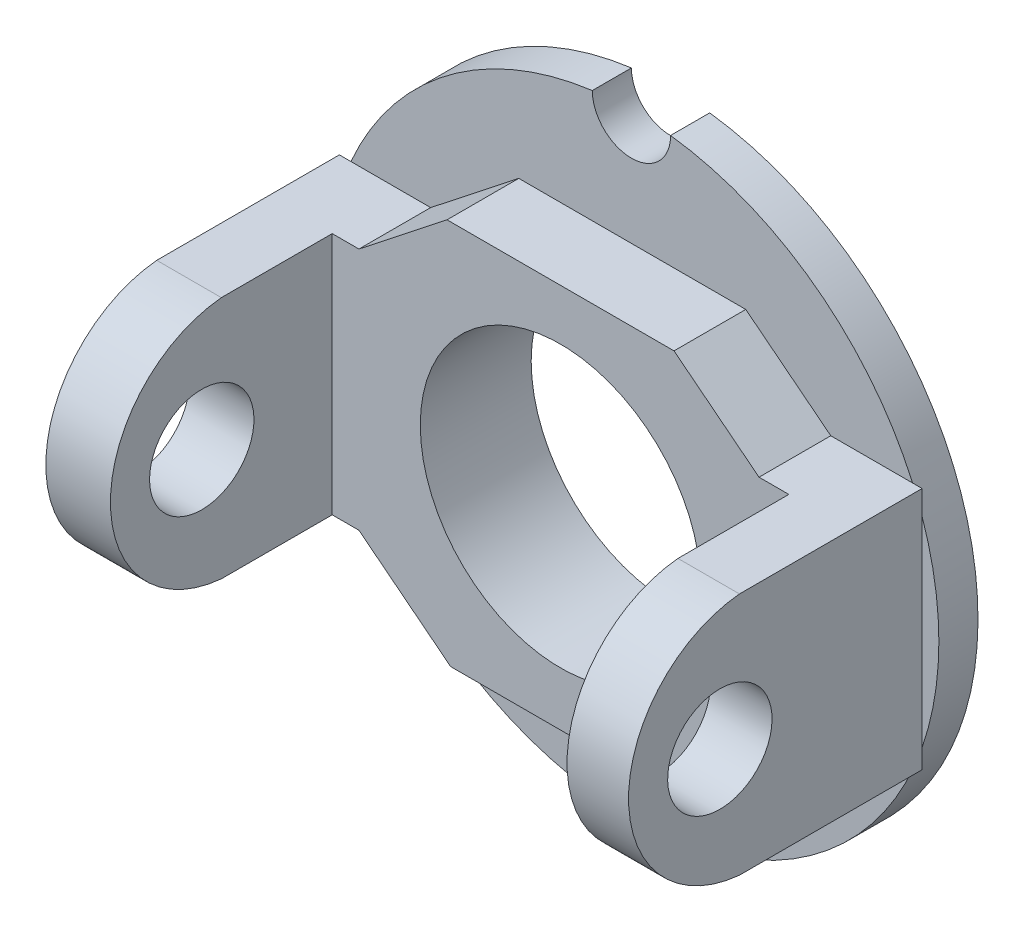
from build123d import *

# Parameters (mm, degrees)
SKETCH1_R           = 10.75
BOSS_EXTRUDE1_DEPTH = 3
SKETCH2_R           = 10.75
SKETCH2_W           = 7
SKETCH2_H           = 18.67
BOSS_EXTRUDE2_DEPTH = 5.5
SKETCH3_W           = 4.95272352
SKETCH3_H           = 18.67
SKETCH3_W_2         = 4.714710678
BOSS_EXTRUDE3_DEPTH = 17
CUT_EXTRUDE1_DEPTH  = 17
SKETCH5_R           = 4
CUT_EXTRUDE2_DEPTH  = 17
CUT_EXTRUDE3_DEPTH  = 17
SKETCH7_R           = 4
CUT_EXTRUDE4_DEPTH  = 17


with BuildPart() as part:
    # Sketch1 → Boss-Extrude1 (new body)
    with BuildSketch(Plane.XY):
        with BuildLine():
            ThreePointArc((2.933453688, 23.316192859), (0.067095287, -23.499904217), (-3.066546312, 23.299062078))
            ThreePointArc((-3.066546312, 23.299062078), (-0.057980921, 20.307627469), (2.933453688, 23.316192859))
        make_face()
        Circle(SKETCH1_R, mode=Mode.SUBTRACT)
    extrude(amount=BOSS_EXTRUDE1_DEPTH)

    # Sketch2 → Boss-Extrude2 (add)
    # profile 1 of 3: a face of its own
    with BuildSketch(Plane.XY.offset(3)):
        Polygon((8.7, 14.650778086), (-8.7, 14.650778086), (-15.45272352, 9.335), (-15.45272352, -9.335), (-8.422507082, -14.869221914), (7.946481399, -14.869221914), (15.214710678, -9.147635088), (15.214710678, 9.522364912), align=None)
        Circle(SKETCH2_R, mode=Mode.SUBTRACT)
    # profile 2 of 3: a face of its own
    with BuildSketch(Plane.XY.offset(3)):
        with Locations((-18.95272352, 0)):
            Rectangle(SKETCH2_W, SKETCH2_H)
    # profile 3 of 3: a face of its own
    with BuildSketch(Plane.XY.offset(3)):
        with Locations((18.714710678, 0.187364912)):
            Rectangle(SKETCH2_W, SKETCH2_H)
    extrude(amount=BOSS_EXTRUDE2_DEPTH)

    # Sketch3 → Boss-Extrude3 (add)
    with BuildSketch(Plane.XY.offset(8.5)):
        with Locations((-19.97636176, 0)):
            Rectangle(SKETCH3_W, SKETCH3_H)
        with Locations((19.857355339, 0.187364912)):
            Rectangle(SKETCH3_W_2, SKETCH3_H)
    extrude(amount=BOSS_EXTRUDE3_DEPTH)

    # Sketch4 → Cut-Extrude1 (cut)
    with BuildSketch(Plane.ZY.offset(22.45272352)):
        with BuildLine():
            Line((17, 9.335), (17, 13.633615677))
            Line((17, 13.633615677), (31.027251007, 13.633615677))
            Line((31.027251007, 13.633615677), (31.027251007, -15.42955238))
            Line((31.027251007, -15.42955238), (17, -15.42955238))
            Line((17, -15.42955238), (17, -9.335))
            ThreePointArc((17, -9.335), (25.5, 0), (17, 9.335))
        make_face()
    extrude(amount=-CUT_EXTRUDE1_DEPTH, mode=Mode.SUBTRACT)

    # Sketch5 → Cut-Extrude2 (cut)
    with BuildSketch(Plane.ZY.offset(22.45272352)):
        with Locations((18.500000216, 0.001740409)):
            Circle(SKETCH5_R)
    extrude(amount=-CUT_EXTRUDE2_DEPTH, mode=Mode.SUBTRACT)

    # Sketch6 → Cut-Extrude3 (cut)
    with BuildSketch(Plane(origin=(22.214710678, 0, 0), x_dir=(0, 0, -1), z_dir=(1, 0, 0))):
        with BuildLine():
            Line((-17, 9.522364912), (-17, 12.0175707))
            Line((-17, 12.0175707), (-28.32322093, 12.0175707))
            Line((-28.32322093, 12.0175707), (-28.32322093, -10.554300966))
            Line((-28.32322093, -10.554300966), (-17, -10.554300966))
            Line((-17, -10.554300966), (-17, -9.147635088))
            ThreePointArc((-17, -9.147635088), (-25.5, 0.187364912), (-17, 9.522364912))
        make_face()
    extrude(amount=-CUT_EXTRUDE3_DEPTH, mode=Mode.SUBTRACT)

    # Sketch7 → Cut-Extrude4 (cut)
    with BuildSketch(Plane(origin=(22.214710678, 0, 0), x_dir=(0, 0, -1), z_dir=(1, 0, 0))):
        with Locations(Location((-18.503182636, -0.023696141, 0), (0, 0, 90))):
            Circle(SKETCH7_R)
    extrude(amount=-CUT_EXTRUDE4_DEPTH, mode=Mode.SUBTRACT)


solid = part.part
